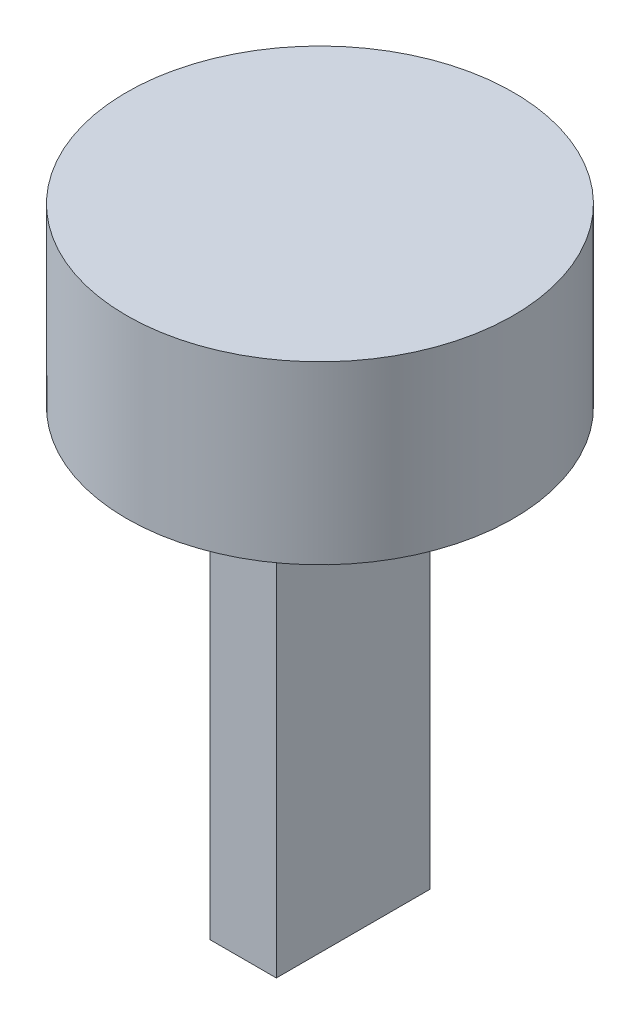
from build123d import *

# Parameters (mm, degrees)
SKETCH1_W           = 1.2
SKETCH1_H           = 2.775
BOSS_EXTRUDE1_DEPTH = 7.9375
SKETCH2_R           = 3.4925
BOSS_EXTRUDE2_DEPTH = 3.175


with BuildPart() as part:
    # Sketch1 → Boss-Extrude1 (new body)
    with BuildSketch(Plane(origin=(0, 0, 0), x_dir=(1, 0, 0), z_dir=(0, 1, 0))):
        Rectangle(SKETCH1_W, SKETCH1_H)
    extrude(amount=BOSS_EXTRUDE1_DEPTH)

    # Sketch2 → Boss-Extrude2 (add)
    with BuildSketch(Plane(origin=(0, 7.9375, 0), x_dir=(1, 0, 0), z_dir=(0, 1, 0))):
        with Locations(Location((0, 0, 0), (0, 0, 270))):
            Circle(SKETCH2_R)
    extrude(amount=BOSS_EXTRUDE2_DEPTH)


solid = part.part
